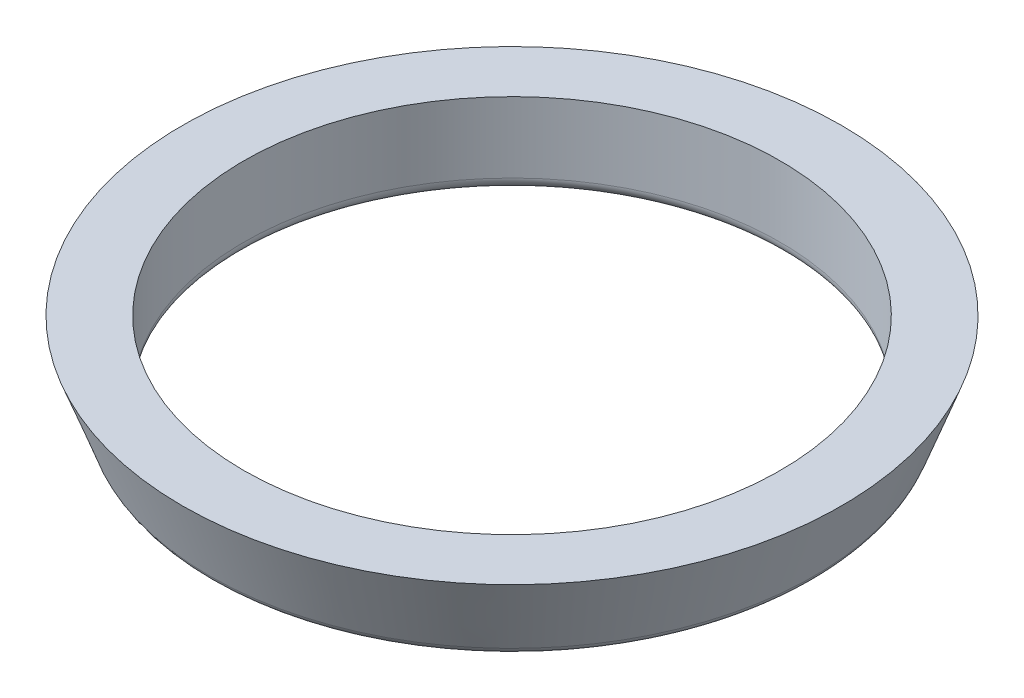
from build123d import *


with BuildPart() as part:
    # Sketch2 → Revolve1 (revolve)
    with BuildSketch(Plane(origin=(0, 0, 0), x_dir=(0, 0, -1), z_dir=(1, 0, 0))):
        with BuildLine():
            Line((-107.5, 0), (-98.466941695, -24.389257423))
            ThreePointArc((-98.466941695, -24.389257423), (-97.001003578, -26.283064856), (-94.715946652, -27))
            Line((-94.715946652, -27), (-91.5, -27))
            ThreePointArc((-91.5, -27), (-88.671572875, -25.828427125), (-87.5, -23))
            Line((-87.5, -23), (-87.5, 0))
            Line((-87.5, 0), (-107.5, 0))
        make_face()
    revolve(axis=Axis((0, 0, 0), (0, -1, 0)))


solid = part.part
